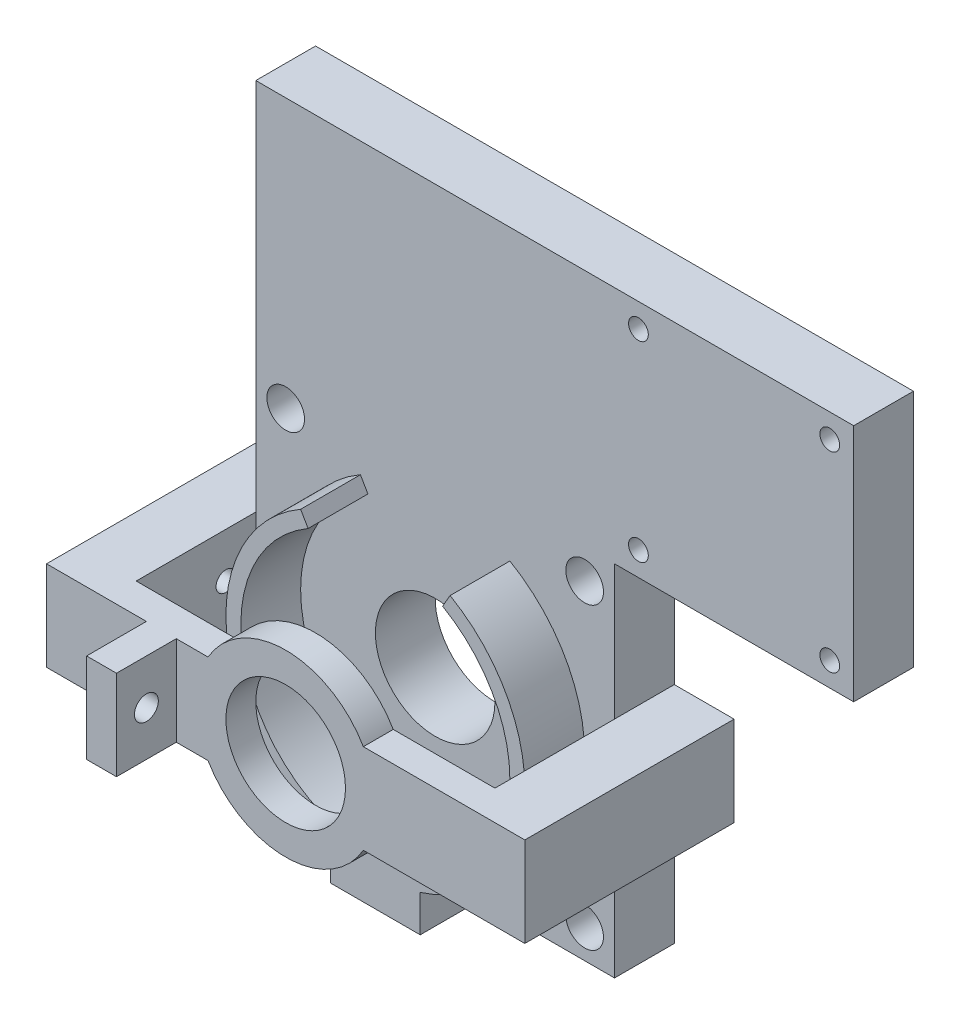
from build123d import *

# Parameters (mm, degrees)
SKETCH1_W               = 60
SKETCH1_H               = 60
BOSS_EXTRUDE1_DEPTH     = 10
BOSS_EXTRUDE2_DEPTH     = 10
SKETCH3_R               = 10
CUT_EXTRUDE1_DEPTH      = 44.588989435
SKETCH4_R               = 3.15
CUT_EXTRUDE2_DEPTH      = 44.588989435
SKETCH5_W               = 10
SKETCH5_H               = 15
BOSS_EXTRUDE3_DEPTH     = 45
BOSS_EXTRUDE4_START     = 5
SKETCH6_R               = 10
BOSS_EXTRUDE4_DEPTH     = 5
CUT_EXTRUDE4_REACH      = 87
CUT_EXTRUDE4_END_RADIUS = 22.5
SKETCH7_R               = 1.65
SKETCH8_W               = 11.7
SKETCH8_H               = 15
BOSS_EXTRUDE5_DEPTH     = 10
SKETCH9_W               = 16.7
SKETCH9_H               = 10
CUT_EXTRUDE5_DEPTH      = 71.931304796
CUT_EXTRUDE6_REACH      = 85.258
SKETCH11_R              = 2
SKETCH12_W              = 10
SKETCH12_H              = 15
CUT_EXTRUDE7_DEPTH      = 10
SKETCH15_R              = 1.65
CUT_EXTRUDE8_DEPTH      = 10
LPATTERN1_COUNT         = 3
LPATTERN1_PITCH         = 10
SKETCH16_W              = 100
SKETCH16_H              = 40
BOSS_EXTRUDE6_DEPTH     = 10
SKETCH17_R              = 1.65
CUT_EXTRUDE9_DEPTH      = 106


with BuildPart() as part:
    # Sketch1 → Boss-Extrude1 (new body)
    with BuildSketch(Plane.XY):
        Rectangle(SKETCH1_W, SKETCH1_H)
    extrude(amount=BOSS_EXTRUDE1_DEPTH)

    # Sketch2 → Boss-Extrude2 (add)
    with BuildSketch(Plane.XY.offset(10)):
        with BuildLine():
            Line((-11.25, 19.485571585), (-12.5, 21.650635095))
            ThreePointArc((-12.5, 21.650635095), (-24.850399784, -2.730866272), (-7.5, -23.848480035))
            Line((-7.5, -23.848480035), (-7.5, -30))
            Line((-7.5, -30), (7.5, -30))
            Line((7.5, -30), (7.5, -23.848480035))
            ThreePointArc((7.5, -23.848480035), (24.850399784, -2.730866272), (12.5, 21.650635095))
            Line((12.5, 21.650635095), (11.25, 19.485571585))
            ThreePointArc((11.25, 19.485571585), (0, -22.5), (-11.25, 19.485571585))
        make_face()
    extrude(amount=BOSS_EXTRUDE2_DEPTH)

    # Sketch3 → Cut-Extrude1 (cut, through all)
    with BuildSketch(Plane.XY.offset(10)):
        Circle(SKETCH3_R)
    extrude(amount=-CUT_EXTRUDE1_DEPTH, mode=Mode.SUBTRACT)

    # Sketch4 → Cut-Extrude2 (cut, through all)
    with BuildSketch(Plane.XY.offset(10)):
        with Locations((-25, 25)):
            Circle(SKETCH4_R)
        with Locations((25, 25)):
            Circle(SKETCH4_R)
        with Locations((25, -25)):
            Circle(SKETCH4_R)
        with Locations((-25, -25)):
            Circle(SKETCH4_R)
    extrude(amount=-CUT_EXTRUDE2_DEPTH, mode=Mode.SUBTRACT)

    # Sketch5 → Boss-Extrude3 (add)
    with BuildSketch(Plane(origin=(0, 0, 0), x_dir=(-1, 0, 0), z_dir=(0, 0, -1))):
        with Locations((35, 0)):
            Rectangle(SKETCH5_W, SKETCH5_H)
    boss_extrude3 = extrude(amount=-BOSS_EXTRUDE3_DEPTH)

    # Mirror1: Boss-Extrude3 across plane
    add(boss_extrude3.mirror(Plane.ZY))

    # Sketch6 → Boss-Extrude4 (add)
    with BuildSketch(Plane.XY.offset(30).offset(BOSS_EXTRUDE4_START)):
        with BuildLine():
            Line((30, 7.5), (12.990381057, 7.5))
            ThreePointArc((12.990381057, 7.5), (0, 15), (-12.990381057, 7.5))
            Line((-12.990381057, 7.5), (-30, 7.5))
            Line((-30, 7.5), (-30, -7.5))
            Line((-30, -7.5), (-12.990381057, -7.5))
            ThreePointArc((-12.990381057, -7.5), (0, -15), (12.990381057, -7.5))
            Line((12.990381057, -7.5), (30, -7.5))
            Line((30, -7.5), (30, 7.5))
        make_face()
        Circle(SKETCH6_R, mode=Mode.SUBTRACT)
    extrude(amount=-BOSS_EXTRUDE4_DEPTH)

    # Cut-Extrude4: up to this cylinder (the profile starts outside it)
    cut_extrude4_end = Plane(origin=(0, 0, 15), z_dir=(0, 0, -1)) * Cylinder(CUT_EXTRUDE4_END_RADIUS, 220, mode=Mode.PRIVATE)
    # Sketch7 → Cut-Extrude4 (cut, up to the surface)
    with BuildSketch(Plane(origin=(0, -30, 0), x_dir=(-1, 0, 0), z_dir=(0, -1, 0)), mode=Mode.PRIVATE) as cut_extrude4_sk1:
        with Locations(Location((0, -15, 0), (0, 0, 90))):
            Circle(SKETCH7_R)
    cut_extrude4_tool1 = extrude(cut_extrude4_sk1.sketch, amount=-CUT_EXTRUDE4_REACH, mode=Mode.PRIVATE) - cut_extrude4_end
    add(cut_extrude4_tool1.solids().sort_by_distance((0, -30, 15))[0], mode=Mode.SUBTRACT)

    # Sketch8 → Boss-Extrude5 (add)
    with BuildSketch(Plane.XY.offset(35)):
        with Locations((-24.15, 0)):
            Rectangle(SKETCH8_W, SKETCH8_H)
    extrude(amount=BOSS_EXTRUDE5_DEPTH)

    # Sketch9 → Cut-Extrude5 (cut, through all)
    with BuildSketch(Plane.XZ.offset(7.5)):
        with Locations((-31.65, 40)):
            Rectangle(SKETCH9_W, SKETCH9_H)
    extrude(amount=-CUT_EXTRUDE5_DEPTH, mode=Mode.SUBTRACT)

    # Sketch11 → Cut-Extrude6 (cut, up to next)
    with BuildSketch(Plane.ZY.offset(23.3), mode=Mode.PRIVATE) as cut_extrude6_sk1:
        with Locations((40, 0)):
            Circle(SKETCH11_R)
    cut_extrude6_tool1 = extrude(cut_extrude6_sk1.sketch, amount=-CUT_EXTRUDE6_REACH, mode=Mode.PRIVATE) & part.part
    add(cut_extrude6_tool1.solids().sort_by_distance((-23.3, 0, 40))[0], mode=Mode.SUBTRACT)

    # Sketch12 → Cut-Extrude7 (cut)
    with BuildSketch(Plane.ZY.offset(-30)):
        with Locations((40, 0)):
            Rectangle(SKETCH12_W, SKETCH12_H)
    extrude(amount=-CUT_EXTRUDE7_DEPTH, mode=Mode.SUBTRACT)

    # Sketch15 → Cut-Extrude8 (cut)
    with BuildSketch(Plane.ZY.offset(40)):
        with Locations(Location((5, 0, 0), (0, 0, 270))):
            Circle(SKETCH15_R)
    cut_extrude8 = extrude(amount=-CUT_EXTRUDE8_DEPTH, mode=Mode.SUBTRACT)

    # LPattern1: Cut-Extrude8 ×3
    with Locations(*[(0, 0, i * LPATTERN1_PITCH) for i in range(1, LPATTERN1_COUNT)]):
        add(cut_extrude8, mode=Mode.SUBTRACT)

    # Sketch16 → Boss-Extrude6 (add)
    with BuildSketch(Plane(origin=(0, 0, 0), x_dir=(-1, 0, 0), z_dir=(0, 0, -1))):
        with Locations((-20, 50)):
            Rectangle(SKETCH16_W, SKETCH16_H)
    extrude(amount=-BOSS_EXTRUDE6_DEPTH)

    # Sketch17 → Cut-Extrude9 (cut, through all)
    with BuildSketch(Plane.XY.offset(10)):
        with Locations((66, 34)):
            Circle(SKETCH17_R)
        with Locations((66, 66)):
            Circle(SKETCH17_R)
        with Locations((34, 66)):
            Circle(SKETCH17_R)
        with Locations((34, 34)):
            Circle(SKETCH17_R)
    extrude(amount=-CUT_EXTRUDE9_DEPTH, mode=Mode.SUBTRACT)


solid = part.part
